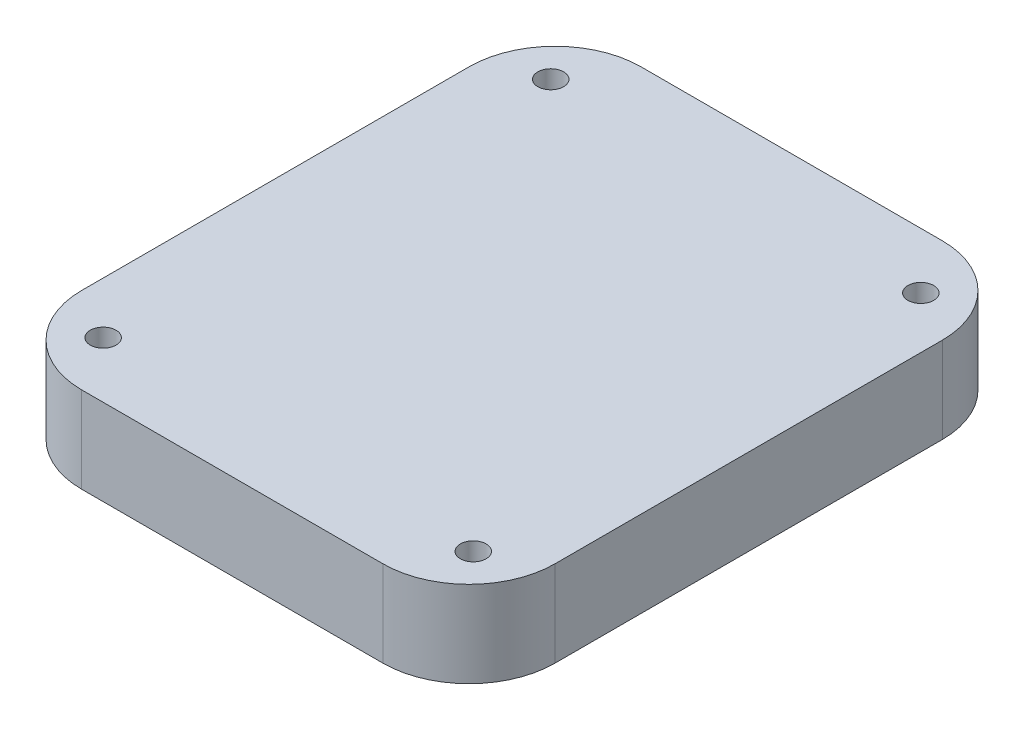
from build123d import *

# Parameters (mm, degrees)
BOSS_EXTRUDE1_DEPTH = 10
SKETCH3_R           = 1.5
CUT_EXTRUDE3_DEPTH  = 44.732139211


with BuildPart() as part:
    # Sketch1 → Boss-Extrude1 (new body)
    with BuildSketch(Plane(origin=(0, 0, 0), x_dir=(1, 0, 0), z_dir=(0, 1, 0))):
        with BuildLine():
            Line((-17.5, 32.5), (17.5, 32.5))
            ThreePointArc((17.5, 32.5), (24.571067812, 29.571067812), (27.5, 22.5))
            Line((27.5, 22.5), (27.5, -22.5))
            ThreePointArc((27.5, -22.5), (24.571067812, -29.571067812), (17.5, -32.5))
            Line((17.5, -32.5), (-17.5, -32.5))
            ThreePointArc((-17.5, -32.5), (-24.571067812, -29.571067812), (-27.5, -22.5))
            Line((-27.5, -22.5), (-27.5, 22.5))
            ThreePointArc((-27.5, 22.5), (-24.571067812, 29.571067812), (-17.5, 32.5))
        make_face()
    extrude(amount=BOSS_EXTRUDE1_DEPTH)

    # Sketch3 → Cut-Extrude3 (cut, through all)
    with BuildSketch(Plane(origin=(0, 10, 0), x_dir=(1, 0, 0), z_dir=(0, 1, 0))):
        with Locations(Location((-21.5, 26, 0), (0, 0, 270))):
            Circle(SKETCH3_R)
        with Locations(Location((21.5, 26, 0), (0, 0, 270))):
            Circle(SKETCH3_R)
        with Locations(Location((21.5, -26, 0), (0, 0, 270))):
            Circle(SKETCH3_R)
        with Locations(Location((-21.5, -26, 0), (0, 0, 270))):
            Circle(SKETCH3_R)
    extrude(amount=-CUT_EXTRUDE3_DEPTH, mode=Mode.SUBTRACT)


solid = part.part
